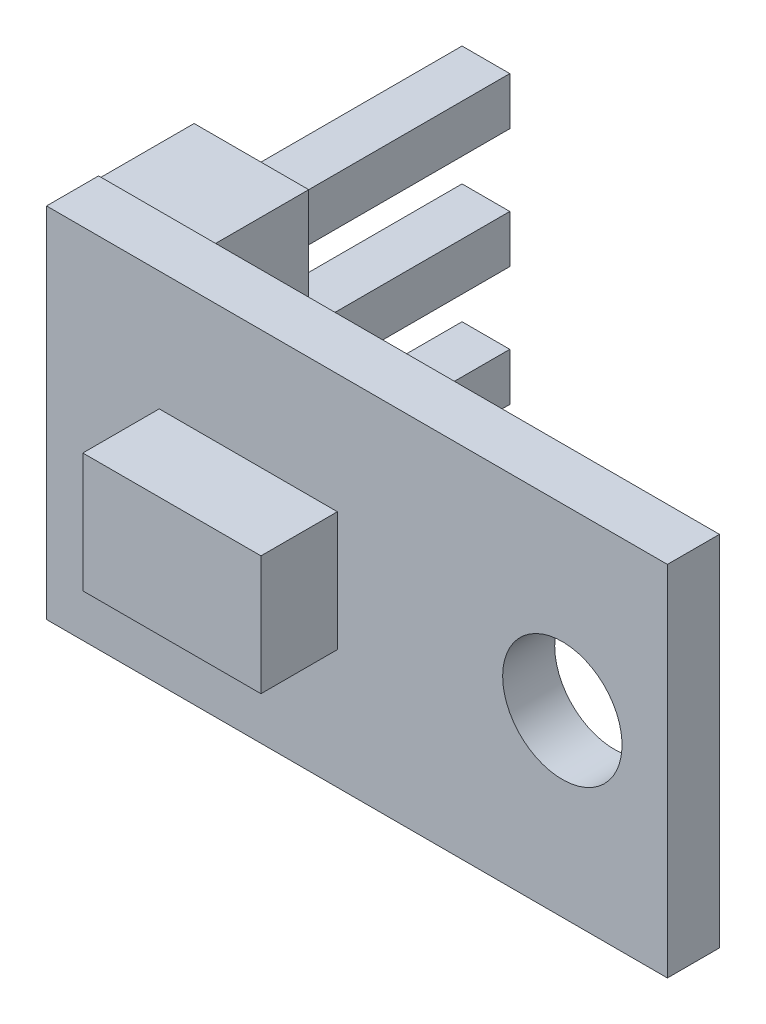
from build123d import *

# Parameters (mm, degrees)
ESQUISSE1_W             = 13
ESQUISSE1_H             = 7.5
BOSS_EXTRU_3_DEPTH      = 1.09
ESQUISSE4_W             = 3.73
ESQUISSE4_H             = 2.5
BOSS_EXTRU_4_DEPTH      = 1.6
ESQUISSE5_W             = 1
ESQUISSE5_H             = 1
BOSS_EXTRU_5_DEPTH      = 8
ESQUISSE6_W             = 2.4
ESQUISSE6_H             = 2.4
ESQUISSE6_W_2           = 1
ESQUISSE6_H_2           = 1
BOSS_EXTRU_6_DEPTH      = 2
BOSS_EXTRU_6_2_DEPTH    = 2
BOSS_EXTRU_6_3_DEPTH    = 2
ESQUISSE7_R             = 1.25
ENL_V_MAT_EXTRU_1_DEPTH = 32.020050982


with BuildPart() as part:
    # Esquisse1 → Boss.-Extru.3 (new body)
    with BuildSketch(Plane.XY):
        with Locations((-22.795826716, 3.75)):
            Rectangle(ESQUISSE1_W, ESQUISSE1_H)
    extrude(amount=BOSS_EXTRU_3_DEPTH)

    # Esquisse4 → Boss.-Extru.4 (add)
    with BuildSketch(Plane.XY.offset(1.09)):
        with Locations((-25.070826716, 3.75)):
            Rectangle(ESQUISSE4_W, ESQUISSE4_H)
    extrude(amount=BOSS_EXTRU_4_DEPTH)

    # Esquisse5 → Boss.-Extru.5 (add)
    with BuildSketch(Plane.XY.offset(1.09)):
        with Locations((-28.095826716, 6.25)):
            Rectangle(ESQUISSE5_W, ESQUISSE5_H)
        with Locations((-28.095826716, 3.75)):
            Rectangle(ESQUISSE5_W, ESQUISSE5_H)
        with Locations((-28.095826716, 1.25)):
            Rectangle(ESQUISSE5_W, ESQUISSE5_H)
    extrude(amount=-BOSS_EXTRU_5_DEPTH)

    # Esquisse7 → Enlèv. mat.-Extru.1 (cut, through all)
    with BuildSketch(Plane(origin=(0, 0, 0), x_dir=(-1, 0, 0), z_dir=(0, 0, -1))):
        with Locations((18.495826716, 3.75)):
            Circle(ESQUISSE7_R)
    extrude(amount=-ENL_V_MAT_EXTRU_1_DEPTH, mode=Mode.SUBTRACT)


with BuildPart() as body_2:
    # Esquisse6 → Boss.-Extru.6 (new body)
    with BuildSketch(Plane(origin=(0, 0, 0), x_dir=(-1, 0, 0), z_dir=(0, 0, -1))):
        with Locations((28.095826716, 6.25)):
            Rectangle(ESQUISSE6_W, ESQUISSE6_H)
        with Locations((28.095826716, 6.25)):
            Rectangle(ESQUISSE6_W_2, ESQUISSE6_H_2, mode=Mode.SUBTRACT)
    extrude(amount=BOSS_EXTRU_6_DEPTH)


with BuildPart() as body_3:
    # Esquisse6 → Boss.-Extru.6 2 (new body)
    with BuildSketch(Plane(origin=(0, 0, 0), x_dir=(-1, 0, 0), z_dir=(0, 0, -1))):
        with Locations((28.095826716, 3.75)):
            Rectangle(ESQUISSE6_W, ESQUISSE6_H)
        with Locations((28.095826716, 3.75)):
            Rectangle(ESQUISSE6_W_2, ESQUISSE6_H_2, mode=Mode.SUBTRACT)
    extrude(amount=BOSS_EXTRU_6_2_DEPTH)


with BuildPart() as body_4:
    # Esquisse6 → Boss.-Extru.6 3 (new body)
    with BuildSketch(Plane(origin=(0, 0, 0), x_dir=(-1, 0, 0), z_dir=(0, 0, -1))):
        with Locations((28.095826716, 1.25)):
            Rectangle(ESQUISSE6_W, ESQUISSE6_H)
        with Locations((28.095826716, 1.25)):
            Rectangle(ESQUISSE6_W_2, ESQUISSE6_H_2, mode=Mode.SUBTRACT)
    extrude(amount=BOSS_EXTRU_6_3_DEPTH)


solid = Compound([part.part, body_2.part, body_3.part, body_4.part])
